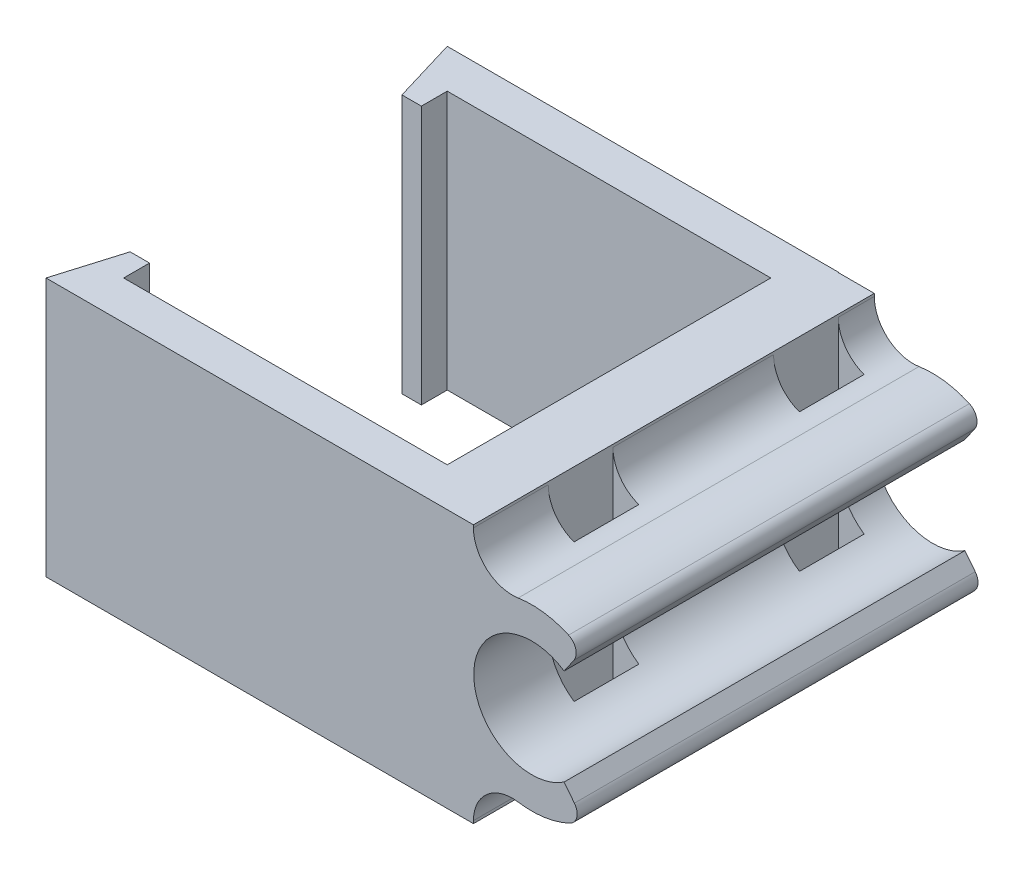
from build123d import *

# Parameters (mm, degrees)
EXTRUDE_1_DEPTH           = 25
CUT_EXTRUDE_4_DEPTH       = 80.457942189
SKETCH_7_W                = 16.60831278
SKETCH_7_H                = 38.473598513
CUT_EXTRUDE_14_DEPTH      = 80.457942189
SKETCH_8_W                = 5
SKETCH_8_H                = 30.968526609
EXTRUDE_2_DEPTH           = 25
CUT_EXTRUDE_15_DEPTH      = 78.792556685
CUT_EXTRUDE_15_DEPTH_BACK = 78.792556685
SKETCH_9_W                = 33.026813651
SKETCH_9_H                = 5
EXTRUDE_3_DEPTH           = 30.968526609
FILLET_1_R                = 3
FILLET_2_R                = 1
SKETCH_11_W               = 2
SKETCH_11_H               = 5
CUT_EXTRUDE_16_DEPTH      = 79.029254622


with BuildPart() as part:
    # Эскиз1 → Бобышка-Вытянуть1 (new body)
    with BuildSketch(Plane(origin=(0, 0, 0), x_dir=(1, 0, 0), z_dir=(0, 1, 0))):
        Polygon((-66.825757576, 34.969739794), (-66.825757576, 29.969739794), (-63.825757576, 29.969739794), (-63.825757576, 31.969739794), (-38.825757576, 31.969739794), (-38.825757576, 6.969739794), (-63.825757576, 6.969739794), (-63.825757576, 8.969739794), (-66.825757576, 8.969739794), (-66.825757576, 3.969739794), (-22.123470102, 3.969739794), (-36.579007505, 34.969739794), align=None)
    extrude(amount=EXTRUDE_1_DEPTH)

    # Эскиз3 → Вырез-Вытянуть4 (cut, through all)
    with BuildSketch(Plane.XZ):
        Polygon((-66.825757576, -3.969739794), (-65.325757576, -8.969739794), (-66.825757576, -8.969739794), align=None)
        Polygon((-66.825757576, -29.969739794), (-66.825757576, -34.969739794), (-65.325757576, -29.969739794), align=None)
    extrude(amount=-CUT_EXTRUDE_4_DEPTH, mode=Mode.SUBTRACT)

    # Эскиз7 → Вырез-Вытянуть14 (cut, through all)
    with BuildSketch(Plane(origin=(0, 0, 0), x_dir=(-1, 0, 0), z_dir=(0, -1, 0))):
        with Locations((27.703474463, 20.539743139)):
            Rectangle(SKETCH_7_W, SKETCH_7_H)
    extrude(amount=-CUT_EXTRUDE_14_DEPTH, mode=Mode.SUBTRACT)

    # Эскиз8 → Бобышка-Вытянуть2 (add)
    with BuildSketch(Plane(origin=(0, 0, 0), x_dir=(-1, 0, 0), z_dir=(0, -1, 0))):
        with Locations((36.298943925, 19.454003098)):
            Rectangle(SKETCH_8_W, SKETCH_8_H)
    extrude(amount=-EXTRUDE_2_DEPTH)

    # Эскиз9 → Вырез-Вытянуть15 (cut, two sides: drawn at the far end of the back side and taken through both)
    with BuildSketch(Plane.XY.offset(-3.969739794).offset(-CUT_EXTRUDE_15_DEPTH_BACK)):
        with Locations((-50.312350751, 2.5)):
            Rectangle(SKETCH_9_W, SKETCH_9_H)
    extrude(amount=CUT_EXTRUDE_15_DEPTH + CUT_EXTRUDE_15_DEPTH_BACK, mode=Mode.SUBTRACT)

    # Эскиз10 → Бобышка-Вытянуть3 (add)
    with BuildSketch(Plane.XY.offset(-3.969739794)):
        with BuildLine():
            Line((-26.798943925, 18.714044563), (-25.41833427, 20.714562355))
            ThreePointArc((-25.41833427, 20.714562355), (-36.206138223, 14.922403986), (-25.290934081, 9.374059074))
            Line((-25.290934081, 9.374059074), (-26.798943925, 11.285955437))
            ThreePointArc((-26.798943925, 11.285955437), (-33.776010712, 15), (-26.798943925, 18.714044563))
        make_face()
    extrude(amount=-EXTRUDE_3_DEPTH)

    # Скругление1
    fillet_1_edges = [part.edges().sort_by_distance(p)[0] for p in [
        (-33.798943925, 9.759260146, -19.454003099),
        (-33.798943925, 20.240739854, -19.454003099),
    ]]
    fillet(fillet_1_edges, radius=FILLET_1_R)

    # Скругление2
    fillet_2_edges = [part.edges().sort_by_distance(p)[0] for p in [
        (-25.41833427, 20.714562355, -19.454003099),
        (-25.290934081, 9.374059074, -19.454003099),
    ]]
    fillet(fillet_2_edges, radius=FILLET_2_R)

    # Эскиз11 → Вырез-Вытянуть16 (cut, through all)
    with BuildSketch(Plane.XZ.offset(-5)):
        with Locations((-32.798943925, -12.244728029)):
            Rectangle(SKETCH_11_W, SKETCH_11_H)
        with Locations((-32.798943925, -29.654311708)):
            Rectangle(SKETCH_11_W, SKETCH_11_H)
    extrude(amount=-CUT_EXTRUDE_16_DEPTH, mode=Mode.SUBTRACT)


solid = part.part
